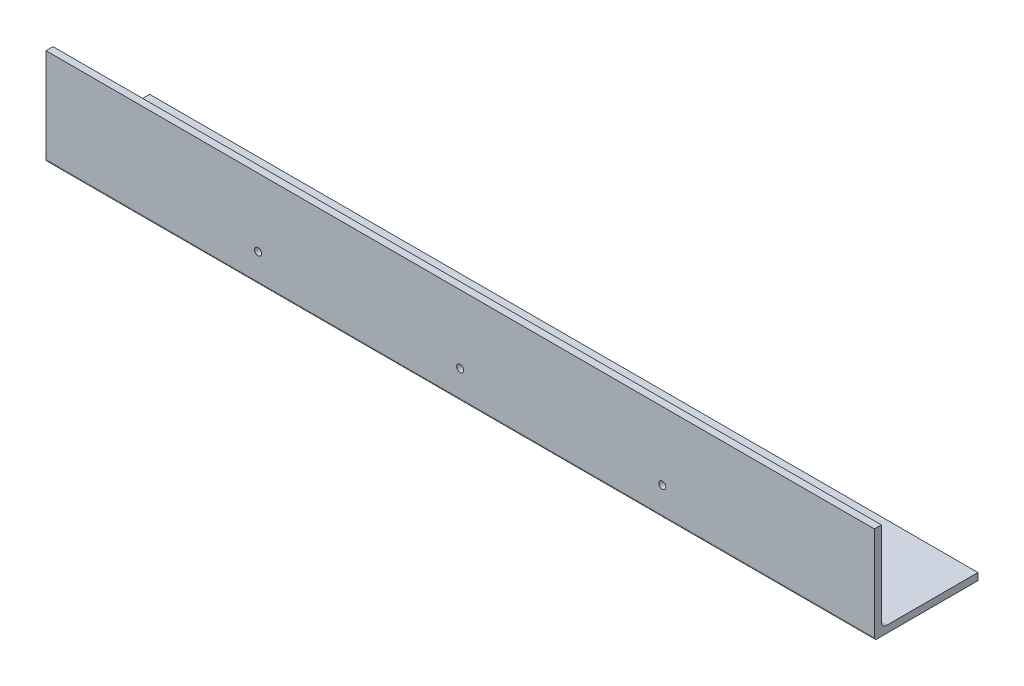
from build123d import *

# Parameters (mm, degrees)
CROQUIS1_W              = 471.25
CROQUIS1_H              = 55
SALIENTE_EXTRUIR1_DEPTH = 4
CROQUIS2_W              = 471.25
CROQUIS2_H              = 4
SALIENTE_EXTRUIR2_DEPTH = 55
REDONDEO1_R             = 3
REDONDEO2_R             = 1.5
CORTAR_EXTRUIR1_REACH   = 246.451
CROQUIS3_R              = 2


with BuildPart() as part:
    # Croquis1 → Saliente-Extruir1 (new body)
    with BuildSketch(Plane.XY):
        Rectangle(CROQUIS1_W, CROQUIS1_H)
    extrude(amount=SALIENTE_EXTRUIR1_DEPTH)

    # Croquis2 → Saliente-Extruir2 (add)
    with BuildSketch(Plane(origin=(0, 0, 0), x_dir=(-1, 0, 0), z_dir=(0, 0, -1))):
        with Locations((0, -25.5)):
            Rectangle(CROQUIS2_W, CROQUIS2_H)
    extrude(amount=SALIENTE_EXTRUIR2_DEPTH)

    # Redondeo1
    redondeo1_edges = [part.edges().sort_by_distance(p)[0] for p in [
        (0, -23.5, 0),
    ]]
    fillet(redondeo1_edges, radius=REDONDEO1_R)

    # Redondeo2
    redondeo2_edges = [part.edges().sort_by_distance(p)[0] for p in [
        (0, -27.5, 4),
    ]]
    fillet(redondeo2_edges, radius=REDONDEO2_R)

    # Croquis3 → Cortar-Extruir1 (cut, up to next)
    with BuildSketch(Plane.XY.offset(4), mode=Mode.PRIVATE) as cortar_extruir1_sk1:
        with Locations((-115, -11.2375)):
            Circle(CROQUIS3_R)
    cortar_extruir1_tool1 = extrude(cortar_extruir1_sk1.sketch, amount=-CORTAR_EXTRUIR1_REACH, mode=Mode.PRIVATE) & part.part
    # Croquis3 → Cortar-Extruir1 (cut, up to next)
    with BuildSketch(Plane.XY.offset(4), mode=Mode.PRIVATE) as cortar_extruir1_sk2:
        with Locations((0, -11.2375)):
            Circle(CROQUIS3_R)
    cortar_extruir1_tool2 = extrude(cortar_extruir1_sk2.sketch, amount=-CORTAR_EXTRUIR1_REACH, mode=Mode.PRIVATE) & part.part
    # Croquis3 → Cortar-Extruir1 (cut, up to next)
    with BuildSketch(Plane.XY.offset(4), mode=Mode.PRIVATE) as cortar_extruir1_sk3:
        with Locations((115, -11.2375)):
            Circle(CROQUIS3_R)
    cortar_extruir1_tool3 = extrude(cortar_extruir1_sk3.sketch, amount=-CORTAR_EXTRUIR1_REACH, mode=Mode.PRIVATE) & part.part
    add(cortar_extruir1_tool1.solids().sort_by_distance((-115, -11.2375, 4))[0], mode=Mode.SUBTRACT)
    add(cortar_extruir1_tool2.solids().sort_by_distance((0, -11.2375, 4))[0], mode=Mode.SUBTRACT)
    add(cortar_extruir1_tool3.solids().sort_by_distance((115, -11.2375, 4))[0], mode=Mode.SUBTRACT)


solid = part.part
